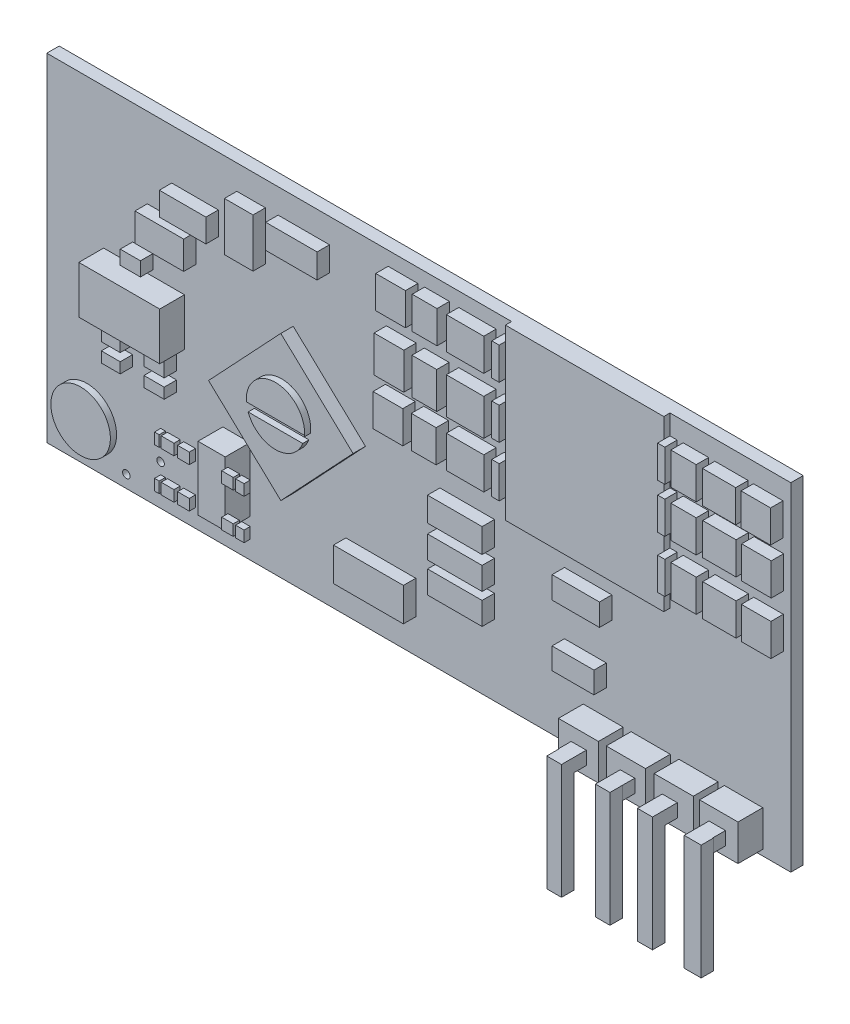
from build123d import *

# Parameters (mm, degrees)
SKETCH2_W               = 30
SKETCH2_H               = 13.6
BOSS_EXTRUDE1_DEPTH     = 0.5
SKETCH3_W               = 6.386163313
SKETCH3_H               = 6.816126675
BOSS_EXTRUDE2_DEPTH     = 0.25
SKETCH4_W               = 0.290280151
SKETCH4_H               = 1.3
SKETCH4_W_2             = 1.024279974
SKETCH4_W_3             = 1.343913442
SKETCH4_W_4             = 1.191361105
SKETCH4_W_5             = 1.343913441
SKETCH4_W_6             = 0.3
SKETCH4_W_7             = 1.508410876
SKETCH4_H_2             = 1.46882673
SKETCH4_W_8             = 1
SKETCH4_H_3             = 1.468826731
SKETCH4_W_9             = 1.2
BOSS_EXTRUDE8_DEPTH     = 0.5
SKETCH5_W               = 2.199713953
SKETCH5_H               = 0.977650646
SKETCH5_H_2             = 0.910992648
SKETCH5_H_3             = 0.910992647
SKETCH5_W_2             = 1.910862626
SKETCH5_H_4             = 0.888773315
SKETCH5_W_3             = 1.688669298
SKETCH5_H_5             = 0.866553981
BOSS_EXTRUDE9_DEPTH     = 0.5
SKETCH6_W               = 1.612284573
SKETCH6_H               = 1.454217458
SKETCH6_W_2             = 1.58067115
SKETCH6_W_3             = 1.549057727
BOSS_EXTRUDE11_DEPTH    = 1
SKETCH7_W               = 0.610622548
SKETCH7_H               = 0.537534916
SKETCH7_W_2             = 0.586699053
SKETCH7_W_3             = 0.605057631
SKETCH7_W_4             = 0.664034454
BOSS_EXTRUDE12_DEPTH    = 0.5
SKETCH8_W               = 0.593658582
SKETCH8_H               = 4.640254923
SKETCH8_W_2             = 0.585927406
SKETCH8_W_3             = 0.605057631
SKETCH8_W_4             = 0.683323228
BOSS_EXTRUDE13_DEPTH    = 0.5
BOSS_EXTRUDE14_DEPTH    = 0.5
SKETCH10_R              = 1.174039664
BOSS_EXTRUDE16_DEPTH    = 0.25
SKETCH12_W              = 2.335237604
SKETCH12_H              = 0.31634767
CUT_EXTRUDE6_DEPTH      = 0.25
SKETCH13_R              = 1.2
BOSS_EXTRUDE17_DEPTH    = 0.25
SKETCH14_W              = 1.096613902
SKETCH14_H              = 2.580268005
BOSS_EXTRUDE19_DEPTH    = 1
SKETCH15_W              = 0.472185804
SKETCH15_H              = 0.443128216
BOSS_EXTRUDE20_DEPTH    = 0.25
SKETCH15_W_2            = 0.515772185
BOSS_EXTRUDE20_2_DEPTH  = 0.25
SKETCH15_W_3            = 0.188874322
BOSS_EXTRUDE20_3_DEPTH  = 0.25
BOSS_EXTRUDE20_4_DEPTH  = 0.25
BOSS_EXTRUDE20_5_DEPTH  = 0.25
BOSS_EXTRUDE20_6_DEPTH  = 0.25
SKETCH15_W_4            = 0.464921407
BOSS_EXTRUDE20_7_DEPTH  = 0.25
SKETCH15_W_5            = 0.341426658
BOSS_EXTRUDE20_8_DEPTH  = 0.25
BOSS_EXTRUDE20_9_DEPTH  = 0.25
BOSS_EXTRUDE20_10_DEPTH = 0.25
SKETCH16_R              = 0.15
CUT_EXTRUDE7_DEPTH      = 4.25
SKETCH17_W              = 1.963867697
SKETCH17_H              = 1.131358565
SKETCH17_W_2            = 1.878482144
SKETCH17_H_2            = 0.939241072
SKETCH17_W_3            = 1.152704952
SKETCH17_H_3            = 1.963867697
SKETCH17_W_4            = 2.070599637
SKETCH17_H_4            = 0.981933849
SKETCH17_W_5            = 2.817723217
SKETCH17_H_5            = 1.344822444
BOSS_EXTRUDE22_DEPTH    = 0.5
SKETCH19_W              = 3.260020377
SKETCH19_H              = 1.913490221
BOSS_EXTRUDE26_DEPTH    = 1
SKETCH22_W              = 0.761852588
SKETCH22_H              = 0.726417584
BOSS_EXTRUDE27_DEPTH    = 0.5
SKETCH22_H_2            = 0.42522005
BOSS_EXTRUDE27_2_DEPTH  = 0.5
SKETCH22_W_2            = 0.815005094
BOSS_EXTRUDE27_3_DEPTH  = 0.5
BOSS_EXTRUDE27_4_DEPTH  = 0.5
SKETCH22_H_3            = 0.566960065
BOSS_EXTRUDE27_5_DEPTH  = 0.5


with BuildPart() as part:
    # Sketch2 → Boss-Extrude1 (new body)
    with BuildSketch(Plane.XY):
        with Locations((5.994594595, -3.231531532)):
            Rectangle(SKETCH2_W, SKETCH2_H)
    extrude(amount=BOSS_EXTRUDE1_DEPTH)

    # Sketch3 → Boss-Extrude2 (add)
    with BuildSketch(Plane.XY.offset(0.5)):
        with Locations((12.929064859, 0.160405131)):
            Rectangle(SKETCH3_W, SKETCH3_H)
    extrude(amount=BOSS_EXTRUDE2_DEPTH)

    # Sketch4 → Boss-Extrude8 (add)
    with BuildSketch(Plane.XY.offset(0.5)):
        with Locations((16.26728659, 2.118468468)):
            Rectangle(SKETCH4_W, SKETCH4_H)
        with Locations((17.168061387, 2.143275217)):
            Rectangle(SKETCH4_W_2, SKETCH4_H)
        with Locations((18.601724294, 2.137041089)):
            Rectangle(SKETCH4_W_3, SKETCH4_H)
        with Locations((20.082372928, 2.129918347)):
            Rectangle(SKETCH4_W_4, SKETCH4_H)
        with Locations((16.26728659, 0.302341793)):
            Rectangle(SKETCH4_W, SKETCH4_H)
        with Locations((18.615081165, 0.32207779)):
            Rectangle(SKETCH4_W_5, SKETCH4_H)
        with Locations((17.168061387, 0.286102828)):
            Rectangle(SKETCH4_W_2, SKETCH4_H)
        with Locations((20.109086668, 0.29536405)):
            Rectangle(SKETCH4_W_4, SKETCH4_H)
        with Locations((16.26728659, -1.797658207)):
            Rectangle(SKETCH4_W, SKETCH4_H)
        with Locations((17.168061387, -1.785825204)):
            Rectangle(SKETCH4_W_2, SKETCH4_H)
        with Locations((18.615081165, -1.812538944)):
            Rectangle(SKETCH4_W_5, SKETCH4_H)
        with Locations((20.095729797, -1.825895814)):
            Rectangle(SKETCH4_W_4, SKETCH4_H)
        with Locations((9.585983202, -1.797658207)):
            Rectangle(SKETCH4_W_6, SKETCH4_H)
        with Locations((9.585983202, 0.243961642)):
            Rectangle(SKETCH4_W_6, SKETCH4_H)
        with Locations((9.585983202, 2.343961642)):
            Rectangle(SKETCH4_W_6, SKETCH4_H)
        with Locations((8.359864987, 2.343961642)):
            Rectangle(SKETCH4_W_7, SKETCH4_H)
        with Locations((8.359864987, 0.159548277)):
            Rectangle(SKETCH4_W_7, SKETCH4_H_2)
        with Locations((8.359864987, -1.797658207)):
            Rectangle(SKETCH4_W_7, SKETCH4_H)
        with Locations((6.728536638, 2.367272175)):
            Rectangle(SKETCH4_W_8, SKETCH4_H)
        with Locations((6.716881371, 0.147893011)):
            Rectangle(SKETCH4_W_8, SKETCH4_H_3)
        with Locations((6.693570838, -1.809313473)):
            Rectangle(SKETCH4_W_8, SKETCH4_H)
        with Locations((5.357624303, 2.357780797)):
            Rectangle(SKETCH4_W_9, SKETCH4_H)
        with Locations((5.290275318, 0.160725139)):
            Rectangle(SKETCH4_W_9, SKETCH4_H_2)
        with Locations((5.249424791, -1.817798507)):
            Rectangle(SKETCH4_W_9, SKETCH4_H)
    extrude(amount=BOSS_EXTRUDE8_DEPTH)

    # Sketch5 → Boss-Extrude9 (add)
    with BuildSketch(Plane.XY.offset(0.5)):
        with Locations((7.946335762, -4.176902299)):
            Rectangle(SKETCH5_W, SKETCH5_H)
        with Locations((7.946335762, -5.498952604)):
            Rectangle(SKETCH5_W, SKETCH5_H_2)
        with Locations((7.946335762, -6.721015912)):
            Rectangle(SKETCH5_W, SKETCH5_H_3)
        with Locations((12.823479324, -4.399095628)):
            Rectangle(SKETCH5_W_2, SKETCH5_H_4)
        with Locations((12.71238266, -6.876551241)):
            Rectangle(SKETCH5_W_3, SKETCH5_H_5)
    extrude(amount=BOSS_EXTRUDE9_DEPTH)

    # Sketch6 → Boss-Extrude11 (add)
    with BuildSketch(Plane.XY.offset(0.5)):
        with Locations((13.431129457, -9.071023058)):
            Rectangle(SKETCH6_W, SKETCH6_H)
        with Locations((15.343741547, -9.071023058)):
            Rectangle(SKETCH6_W_2, SKETCH6_H)
        with Locations((17.27216035, -9.071023058)):
            Rectangle(SKETCH6_W_2, SKETCH6_H)
        with Locations((19.089932172, -9.071023058)):
            Rectangle(SKETCH6_W_3, SKETCH6_H)
    extrude(amount=BOSS_EXTRUDE11_DEPTH)

    # Sketch7 → Boss-Extrude12 (add)
    with BuildSketch(Plane.XY.offset(1.5)):
        with Locations((13.443185617, -9.16202634)):
            Rectangle(SKETCH7_W, SKETCH7_H)
        with Locations((15.410275085, -9.16202634)):
            Rectangle(SKETCH7_W_2, SKETCH7_H)
        with Locations((17.114751309, -9.16202634)):
            Rectangle(SKETCH7_W_3, SKETCH7_H)
        with Locations((19.02842887, -9.16202634)):
            Rectangle(SKETCH7_W_4, SKETCH7_H)
    extrude(amount=BOSS_EXTRUDE12_DEPTH)

    # Sketch8 → Boss-Extrude13 (add)
    with BuildSketch(Plane.XY.offset(2)):
        with Locations((13.4516676, -11.213386344)):
            Rectangle(SKETCH8_W, SKETCH8_H)
        with Locations((15.409889261, -11.213386344)):
            Rectangle(SKETCH8_W_2, SKETCH8_H)
        with Locations((17.114751309, -11.213386344)):
            Rectangle(SKETCH8_W_3, SKETCH8_H)
        with Locations((19.038073257, -11.213386344)):
            Rectangle(SKETCH8_W_4, SKETCH8_H)
    extrude(amount=BOSS_EXTRUDE13_DEPTH)

    # Sketch9 → Boss-Extrude14 (add)
    with BuildSketch(Plane.XY.offset(0.5)):
        Polygon((0.930818634, -0.999233935), (-1.982414077, -4.100417144), (0.930818634, -6.837090297), (3.844051346, -3.735907088), align=None)
    extrude(amount=BOSS_EXTRUDE14_DEPTH)

    # Sketch10 → Boss-Extrude16 (add)
    with BuildSketch(Plane.XY.offset(1)):
        with Locations((0.963071984, -3.740768691)):
            Circle(SKETCH10_R)
    extrude(amount=BOSS_EXTRUDE16_DEPTH)

    # Sketch12 → Cut-Extrude6 (cut)
    with BuildSketch(Plane.XY.offset(1.25)):
        with Locations((0.96035282, -3.992099253)):
            Rectangle(SKETCH12_W, SKETCH12_H)
    extrude(amount=-CUT_EXTRUDE6_DEPTH, mode=Mode.SUBTRACT)

    # Sketch13 → Boss-Extrude17 (add)
    with BuildSketch(Plane.XY.offset(0.5)):
        with Locations(Location((-7.390545682, -8.35299775, 0), (0, 0, 180))):
            Circle(SKETCH13_R)
    extrude(amount=BOSS_EXTRUDE17_DEPTH)

    # Sketch14 → Boss-Extrude19 (add)
    with BuildSketch(Plane.XY.offset(0.5)):
        with Locations((-1.35916922, -7.224130498)):
            Rectangle(SKETCH14_W, SKETCH14_H)
    extrude(amount=BOSS_EXTRUDE19_DEPTH)

    # Sketch16 → Cut-Extrude7 (cut)
    with BuildSketch(Plane.XY.offset(0.5)):
        with Locations((-5.798763913, -9.529413809)):
            Circle(SKETCH16_R)
        with Locations((-4.415902801, -8.409121263)):
            Circle(SKETCH16_R)
    extrude(amount=-CUT_EXTRUDE7_DEPTH, mode=Mode.SUBTRACT)

    # Sketch17 → Boss-Extrude22 (add)
    with BuildSketch(Plane.XY.offset(0.5)):
        with Locations((-3.968123297, -0.230138396)):
            Rectangle(SKETCH17_W, SKETCH17_H)
        with Locations((-3.028882224, 1.082664466)):
            Rectangle(SKETCH17_W_2, SKETCH17_H_2)
        with Locations((-0.766165095, 1.594977779)):
            Rectangle(SKETCH17_W_3, SKETCH17_H_3)
        with Locations((1.357800512, 2.085944702)):
            Rectangle(SKETCH17_W_4, SKETCH17_H_4)
        with Locations((4.463699968, -8.000223632)):
            Rectangle(SKETCH17_W_5, SKETCH17_H_5)
    extrude(amount=BOSS_EXTRUDE22_DEPTH)

    # Sketch19 → Boss-Extrude26 (add)
    with BuildSketch(Plane.XY.offset(0.5)):
        with Locations((-5.083568129, -3.047717526)):
            Rectangle(SKETCH19_W, SKETCH19_H)
    extrude(amount=BOSS_EXTRUDE26_DEPTH)


with BuildPart() as body_2:
    # Sketch15 → Boss-Extrude20 (new body)
    with BuildSketch(Plane.XY.offset(1.5)):
        with Locations((-2.246318928, -6.459506538)):
            Rectangle(SKETCH15_W, SKETCH15_H)
    extrude(amount=BOSS_EXTRUDE20_DEPTH)


with BuildPart() as body_3:
    # Sketch15 → Boss-Extrude20 2 (new body)
    with BuildSketch(Plane.XY.offset(1.5)):
        with Locations((-2.885585863, -6.459506538)):
            Rectangle(SKETCH15_W_2, SKETCH15_H)
    extrude(amount=BOSS_EXTRUDE20_2_DEPTH)


with BuildPart() as body_4:
    # Sketch15 → Boss-Extrude20 3 (new body)
    with BuildSketch(Plane.XY.offset(1.5)):
        with Locations((-3.317817483, -6.459506538)):
            Rectangle(SKETCH15_W_3, SKETCH15_H)
    extrude(amount=BOSS_EXTRUDE20_3_DEPTH)


with BuildPart() as body_5:
    # Sketch15 → Boss-Extrude20 4 (new body)
    with BuildSketch(Plane.XY.offset(1.5)):
        with Locations((-2.246318928, -8.079467064)):
            Rectangle(SKETCH15_W, SKETCH15_H)
    extrude(amount=BOSS_EXTRUDE20_4_DEPTH)


with BuildPart() as body_6:
    # Sketch15 → Boss-Extrude20 5 (new body)
    with BuildSketch(Plane.XY.offset(1.5)):
        with Locations((-2.885585863, -8.079467064)):
            Rectangle(SKETCH15_W_2, SKETCH15_H)
    extrude(amount=BOSS_EXTRUDE20_5_DEPTH)


with BuildPart() as body_7:
    # Sketch15 → Boss-Extrude20 6 (new body)
    with BuildSketch(Plane.XY.offset(1.5)):
        with Locations((-3.317817483, -8.079467064)):
            Rectangle(SKETCH15_W_3, SKETCH15_H)
    extrude(amount=BOSS_EXTRUDE20_6_DEPTH)


with BuildPart() as body_8:
    # Sketch15 → Boss-Extrude20 7 (new body)
    with BuildSketch(Plane.XY.offset(1.5)):
        with Locations((-0.470173867, -6.459506538)):
            Rectangle(SKETCH15_W_4, SKETCH15_H)
    extrude(amount=BOSS_EXTRUDE20_7_DEPTH)


with BuildPart() as body_9:
    # Sketch15 → Boss-Extrude20 8 (new body)
    with BuildSketch(Plane.XY.offset(1.5)):
        with Locations((0.027437327, -6.459506538)):
            Rectangle(SKETCH15_W_5, SKETCH15_H)
    extrude(amount=BOSS_EXTRUDE20_8_DEPTH)


with BuildPart() as body_10:
    # Sketch15 → Boss-Extrude20 9 (new body)
    with BuildSketch(Plane.XY.offset(1.5)):
        with Locations((-0.470173867, -8.079467064)):
            Rectangle(SKETCH15_W_4, SKETCH15_H)
    extrude(amount=BOSS_EXTRUDE20_9_DEPTH)


with BuildPart() as body_11:
    # Sketch15 → Boss-Extrude20 10 (new body)
    with BuildSketch(Plane.XY.offset(1.5)):
        with Locations((0.027437327, -8.079467064)):
            Rectangle(SKETCH15_W_5, SKETCH15_H)
    extrude(amount=BOSS_EXTRUDE20_10_DEPTH)


with BuildPart() as body_12:
    # Sketch22 → Boss-Extrude27 (new body)
    with BuildSketch(Plane.XY.offset(0.5)):
        with Locations((-5.925149476, -4.544846449)):
            Rectangle(SKETCH22_W, SKETCH22_H)
    extrude(amount=BOSS_EXTRUDE27_DEPTH)


with BuildPart() as body_13:
    # Sketch22 → Boss-Extrude27 2 (new body)
    with BuildSketch(Plane.XY.offset(0.5)):
        with Locations((-5.925149476, -5.439580302)):
            Rectangle(SKETCH22_W, SKETCH22_H_2)
    extrude(amount=BOSS_EXTRUDE27_2_DEPTH)


with BuildPart() as body_14:
    # Sketch22 → Boss-Extrude27 3 (new body)
    with BuildSketch(Plane.XY.offset(0.5)):
        with Locations((-4.179975524, -4.544846449)):
            Rectangle(SKETCH22_W_2, SKETCH22_H)
    extrude(amount=BOSS_EXTRUDE27_3_DEPTH)


with BuildPart() as body_15:
    # Sketch22 → Boss-Extrude27 4 (new body)
    with BuildSketch(Plane.XY.offset(0.5)):
        with Locations((-4.179975524, -5.439580302)):
            Rectangle(SKETCH22_W_2, SKETCH22_H_2)
    extrude(amount=BOSS_EXTRUDE27_4_DEPTH)


with BuildPart() as body_16:
    # Sketch22 → Boss-Extrude27 5 (new body)
    with BuildSketch(Plane.XY.offset(0.5)):
        with Locations((-5.136720635, -1.577164855)):
            Rectangle(SKETCH22_W_2, SKETCH22_H_3)
    extrude(amount=BOSS_EXTRUDE27_5_DEPTH)


solid = Compound([part.part, body_2.part, body_3.part, body_4.part, body_5.part, body_6.part, body_7.part, body_8.part, body_9.part, body_10.part, body_11.part, body_12.part, body_13.part, body_14.part, body_15.part, body_16.part])
